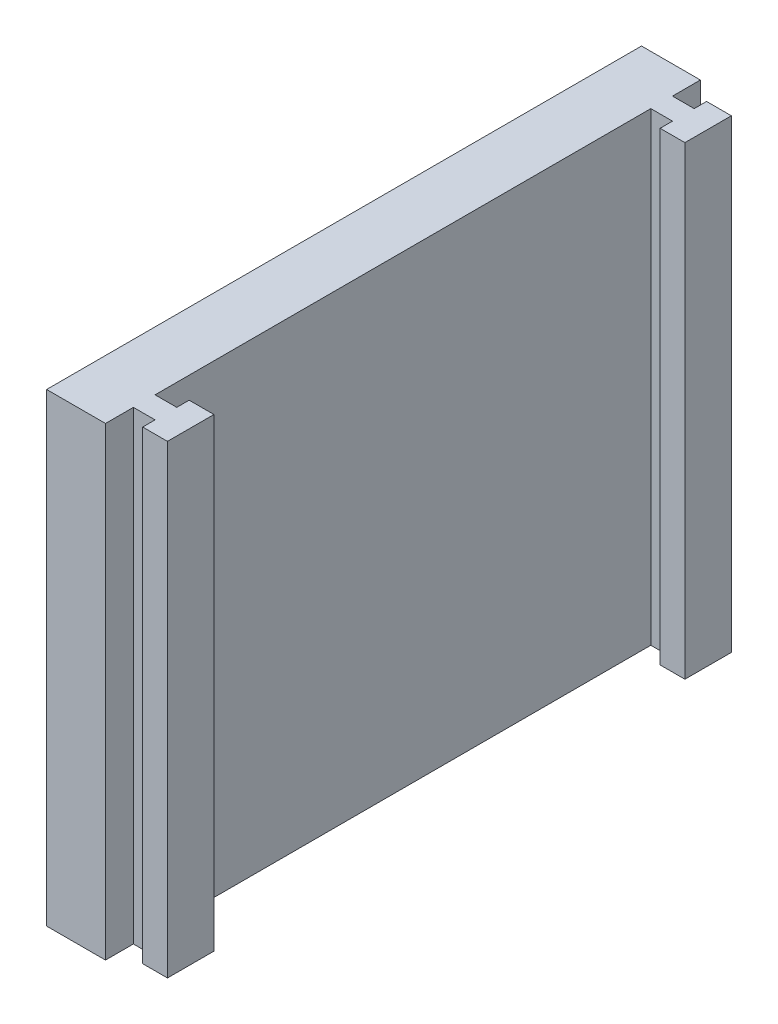
from build123d import *

# Parameters (mm, degrees)
ESTRUSIONE_ESTRUSIONE1_DEPTH = 150
TAGLIO_ESTRUSIONE1_DEPTH     = 145


with BuildPart() as part:
    # Schizzo2 → Estrusione-Estrusione1 (new body)
    with BuildSketch(Plane(origin=(0, 0, 0), x_dir=(1, 0, 0), z_dir=(0, 1, 0))):
        Polygon((19, 96), (19, 87), (26, 87), (26, 91), (34, 91), (34, 76), (26, 76), (26, 80), (19, 80), (19, 0), (0, 0), (0, 96), align=None)
    extrude(amount=ESTRUSIONE_ESTRUSIONE1_DEPTH)

    # Schizzo3 → Taglio-Estrusione1 (cut)
    with BuildSketch(Plane.XZ):
        with BuildLine():
            Line((8.958039892, -91), (5, -91))
            Line((5, -91), (5, -74))
            Line((5, -74), (8.958039892, -74))
            ThreePointArc((8.958039892, -74), (15, -82.5), (8.958039892, -91))
        make_face()
    extrude(amount=-TAGLIO_ESTRUSIONE1_DEPTH, mode=Mode.SUBTRACT)

    # Specchia2: part across plane


with BuildPart() as part_1:
    add(part.part)
    add(part.part.mirror(Plane(origin=(19, 150, 0), x_dir=(1, 0, 0), z_dir=(0, 0, -1))))


solid = part_1.part
